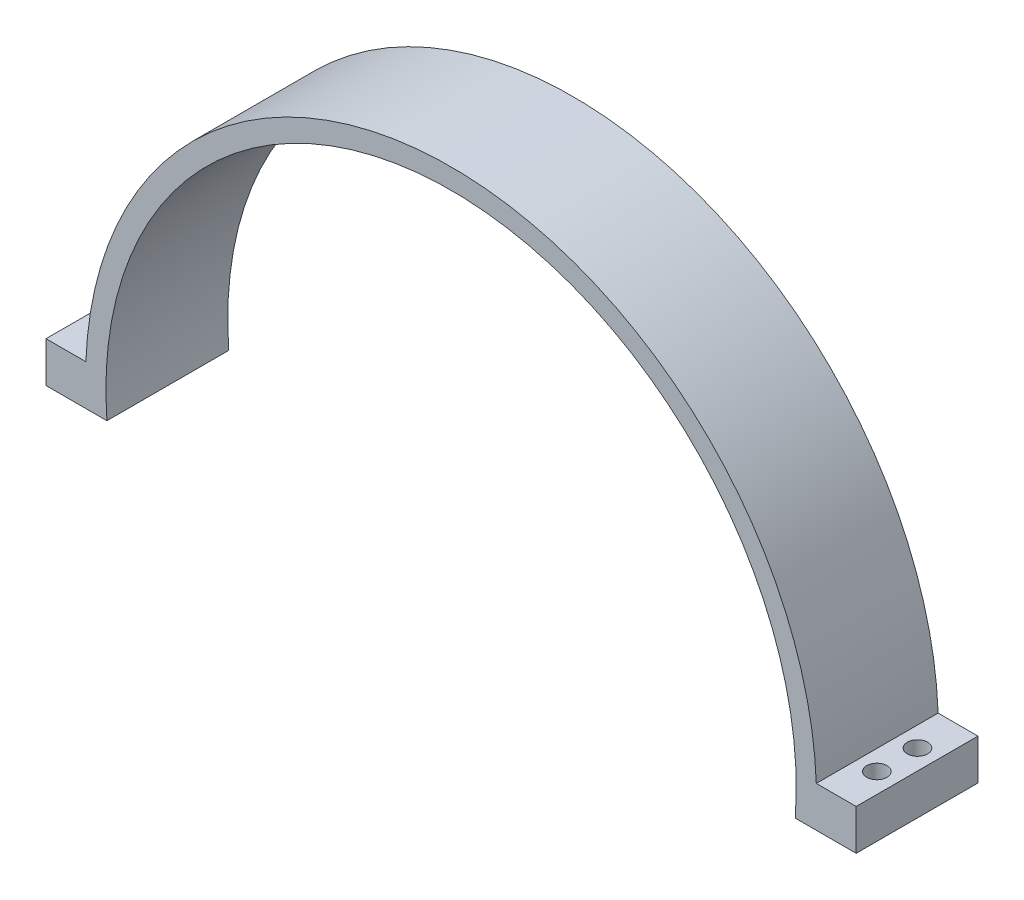
from build123d import *

# Parameters (mm, degrees)
BOSS_EXTRUDE1_DEPTH = 30
SKETCH2_R           = 2.5
CUT_EXTRUDE1_DEPTH  = 30


with BuildPart() as part:
    # Sketch1 → Boss-Extrude1 (new body)
    with BuildSketch(Plane.XY):
        with BuildLine():
            Line((89.932901242, 3.47466175), (99.749159056, 3.47466175))
            Line((99.749159056, 3.47466175), (99.749159056, -6.52533825))
            Line((99.749159056, -6.52533825), (84.749159056, -6.52533825))
            ThreePointArc((84.749159056, -6.52533825), (0, 85), (-84.749159056, -6.52533825))
            Line((-84.749159056, -6.52533825), (-99.749159056, -6.52533825))
            Line((-99.749159056, -6.52533825), (-99.749159056, 3.47466175))
            Line((-99.749159056, 3.47466175), (-89.932901242, 3.47466175))
            ThreePointArc((-89.932901242, 3.47466175), (0, 90), (89.932901242, 3.47466175))
        make_face()
    extrude(amount=BOSS_EXTRUDE1_DEPTH)

    # Sketch2 → Cut-Extrude1 (cut)
    with BuildSketch(Plane(origin=(0, 3.47466175, 0), x_dir=(1, 0, 0), z_dir=(0, 1, 0))):
        with Locations(Location((-94.841030149, -10, 0), (0, 0, 180))):
            Circle(SKETCH2_R)
        with Locations(Location((-94.841030149, -20, 0), (0, 0, 180))):
            Circle(SKETCH2_R)
        with Locations(Location((94.841030149, -20, 0), (0, 0, 180))):
            Circle(SKETCH2_R)
        with Locations(Location((94.841030149, -10, 0), (0, 0, 180))):
            Circle(SKETCH2_R)
    extrude(amount=-CUT_EXTRUDE1_DEPTH, mode=Mode.SUBTRACT)


solid = part.part
